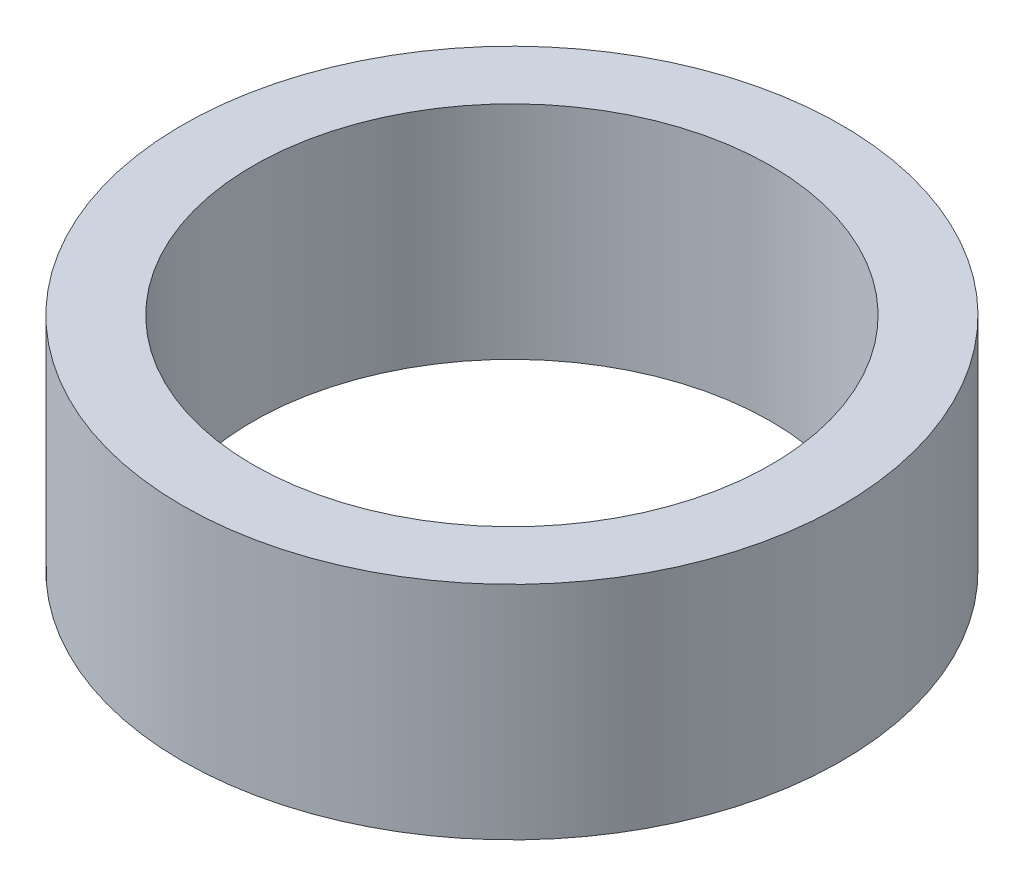
from build123d import *

# Parameters (mm, degrees)
ESQUISSE1_R        = 3.5
ESQUISSE1_R_2      = 2.75
BOSS_EXTRU_1_DEPTH = 2.35


with BuildPart() as part:
    # Esquisse1 → Boss.-Extru.1 (new body)
    with BuildSketch(Plane(origin=(0, 0, 0), x_dir=(1, 0, 0), z_dir=(0, 1, 0))):
        with Locations(Location((0, 0, 0), (0, 0, 270))):
            Circle(ESQUISSE1_R)
        with Locations(Location((0, 0, 0), (0, 0, 270))):
            Circle(ESQUISSE1_R_2, mode=Mode.SUBTRACT)
    extrude(amount=BOSS_EXTRU_1_DEPTH)


solid = part.part
